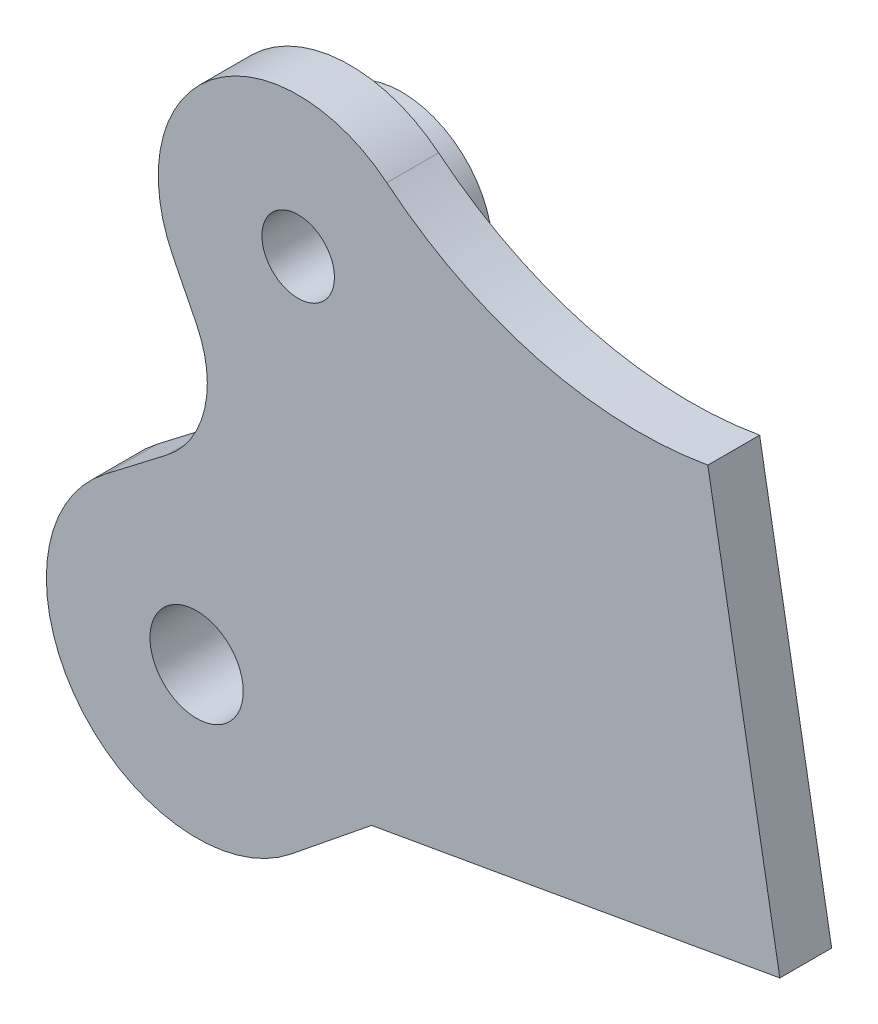
from build123d import *

# Parameters (mm, degrees)
SKETCH1_R           = 3.5
SKETCH1_R_2         = 4.5
BOSS_EXTRUDE1_DEPTH = 5
SKETCH2_R           = 8.75
SKETCH2_R_2         = 3.5
SKETCH2_R_3         = 4.5
BOSS_EXTRUDE2_DEPTH = 5


with BuildPart() as part:
    # Sketch1 → Boss-Extrude1 (new body)
    with BuildSketch(Plane.XY):
        with BuildLine():
            Line((-12.068862554, -6.04917818), (-9.828426191, -10.519127274))
            ThreePointArc((-9.828426191, -10.519127274), (-9.022245749, -17.239185417), (-12.680657026, -22.933492686))
            Line((-12.680657026, -22.933492686), (-18.627117662, -27.496435605))
            ThreePointArc((-18.627117662, -27.496435605), (-21.193595331, -47.96861112), (-0.691265287, -50.281886009))
            Line((-0.691265287, -50.281886009), (7.089345754, -44))
            Line((7.089345754, -44), (46.481655875, -37.054072893))
            Line((46.481655875, -37.054072893), (39.535728768, 2.338237227))
            ThreePointArc((39.535728768, 2.338237227), (23.15933572, 3.004735652), (8.554710295, 10.443511467))
            ThreePointArc((8.554710295, 10.443511467), (-8.431460103, 10.543267071), (-12.068862554, -6.04917818))
        make_face()
        Circle(SKETCH1_R, mode=Mode.SUBTRACT)
        with Locations((-9.8, -39)):
            Circle(SKETCH1_R_2, mode=Mode.SUBTRACT)
    extrude(amount=-BOSS_EXTRUDE1_DEPTH)

    # Sketch2 → Boss-Extrude2 (add)
    # profile 1 of 2: a face of its own
    with BuildSketch(Plane(origin=(0, 0, -5), x_dir=(-1, 0, 0), z_dir=(0, 0, -1))):
        with Locations(Location((0, 0, 0), (0, 0, 180))):
            Circle(SKETCH2_R)
        with Locations(Location((0, 0, 0), (0, 0, 180))):
            Circle(SKETCH2_R_2, mode=Mode.SUBTRACT)
    # profile 2 of 2: a face of its own
    with BuildSketch(Plane(origin=(0, 0, -5), x_dir=(-1, 0, 0), z_dir=(0, 0, -1))):
        with Locations(Location((9.8, -39, 0), (0, 0, 180))):
            Circle(SKETCH2_R)
        with Locations(Location((9.8, -39, 0), (0, 0, 180))):
            Circle(SKETCH2_R_3, mode=Mode.SUBTRACT)
    extrude(amount=BOSS_EXTRUDE2_DEPTH)


solid = part.part
